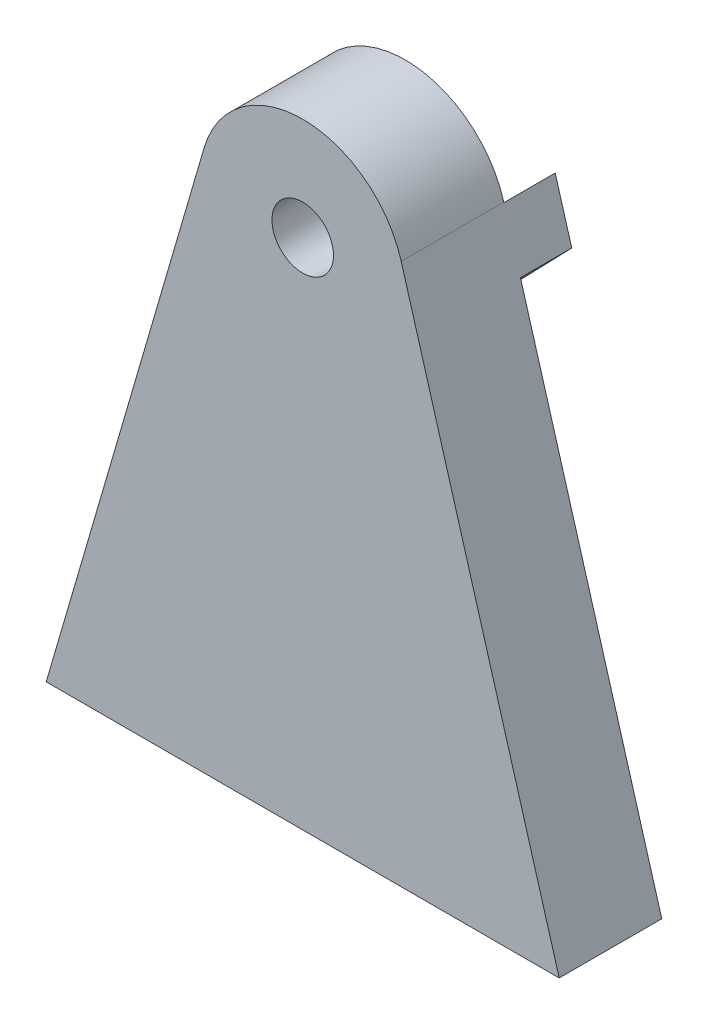
from build123d import *

# Parameters (mm, degrees)
BOSS_EXTRUDE1_DEPTH = 2.54
BOSS_EXTRUDE2_DEPTH = 3.81
SKETCH3_R           = 0.762
CUT_EXTRUDE1_DEPTH  = 2.54


with BuildPart() as part:
    # Sketch1 → Boss-Extrude1 (new body)
    with BuildSketch(Plane.XY):
        with BuildLine():
            Line((-8.7884, 13.4112), (-12.7, 0))
            Line((-12.7, 0), (0, 0))
            Line((0, 0), (-3.9116, 13.4112))
            ThreePointArc((-3.9116, 13.4112), (-6.35, 15.24), (-8.7884, 13.4112))
        make_face()
    extrude(amount=BOSS_EXTRUDE1_DEPTH)

    # Sketch5 → Boss-Extrude2 (add)
    with BuildSketch(Plane.XY.offset(2.54)):
        Polygon((-6.318654584, 10.904222323), (-3.908374337, 13.400140584), (-3.498832415, 11.995996853), (-5.405093038, 10.022006193), align=None)
    extrude(amount=-BOSS_EXTRUDE2_DEPTH)

    # Sketch3 → Cut-Extrude1 (cut)
    with BuildSketch(Plane.XY.offset(2.54)):
        with Locations((-6.35, 12.7)):
            Circle(SKETCH3_R)
    extrude(amount=-CUT_EXTRUDE1_DEPTH, mode=Mode.SUBTRACT)


solid = part.part
